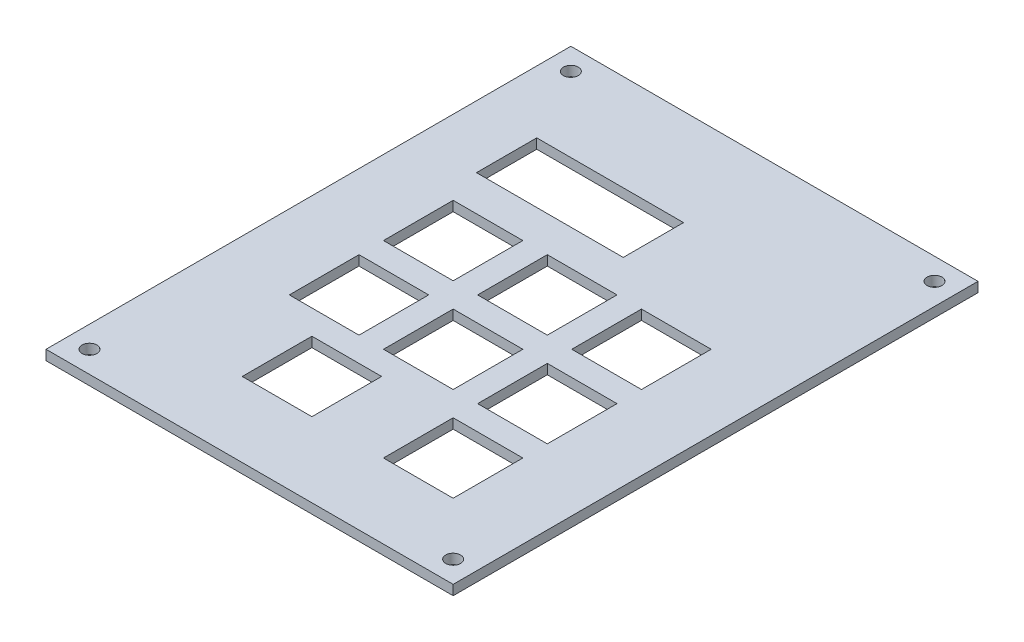
from build123d import *

# Parameters (mm, degrees)
SKETCH1_W           = 82.375
SKETCH1_H           = 106.187
ACRYLIC_SHEET_DEPTH = 2
SKETCH2_R           = 1.5
SKETCH2_W           = 14.1
SKETCH2_H           = 14.1
SKETCH2_W_2         = 29.7
SKETCH2_H_2         = 12.2
ACRYLIC_CUT_DEPTH   = 135.407289959


with BuildPart() as part:
    # Sketch1 → Acrylic-Sheet (new body)
    with BuildSketch(Plane(origin=(0, 0, 0), x_dir=(1, 0, 0), z_dir=(0, 1, 0))):
        with Locations((41.1875, 53.0935)):
            Rectangle(SKETCH1_W, SKETCH1_H)
    extrude(amount=ACRYLIC_SHEET_DEPTH)

    # Sketch2 → Acrylic-Cut (cut, through all)
    with BuildSketch(Plane(origin=(0, 2, 0), x_dir=(1, 0, 0), z_dir=(0, 1, 0))):
        with Locations(Location((4.4, 101.787, 0), (0, 0, 270))):
            Circle(SKETCH2_R)
        with Locations(Location((77.975, 101.787, 0), (0, 0, 270))):
            Circle(SKETCH2_R)
        with Locations(Location((77.975, 4.4, 0), (0, 0, 270))):
            Circle(SKETCH2_R)
        with Locations(Location((4.4, 4.4, 0), (0, 0, 270))):
            Circle(SKETCH2_R)
        with Locations((22.1375, 60.2375)):
            Rectangle(SKETCH2_W, SKETCH2_H)
        with Locations((27.45, 80.587)):
            Rectangle(SKETCH2_W_2, SKETCH2_H_2)
        with Locations((41.1875, 60.2375)):
            Rectangle(SKETCH2_W, SKETCH2_H)
        with Locations((60.2375, 60.2375)):
            Rectangle(SKETCH2_W, SKETCH2_H)
        with Locations((22.1375, 41.1875)):
            Rectangle(SKETCH2_W, SKETCH2_H)
        with Locations((41.1875, 41.1875)):
            Rectangle(SKETCH2_W, SKETCH2_H)
        with Locations((60.2375, 41.1875)):
            Rectangle(SKETCH2_W, SKETCH2_H)
        with Locations((31.6625, 22.1375)):
            Rectangle(SKETCH2_W, SKETCH2_H)
        with Locations((60.2375, 22.1375)):
            Rectangle(SKETCH2_W, SKETCH2_H)
    extrude(amount=-ACRYLIC_CUT_DEPTH, mode=Mode.SUBTRACT)


solid = part.part
